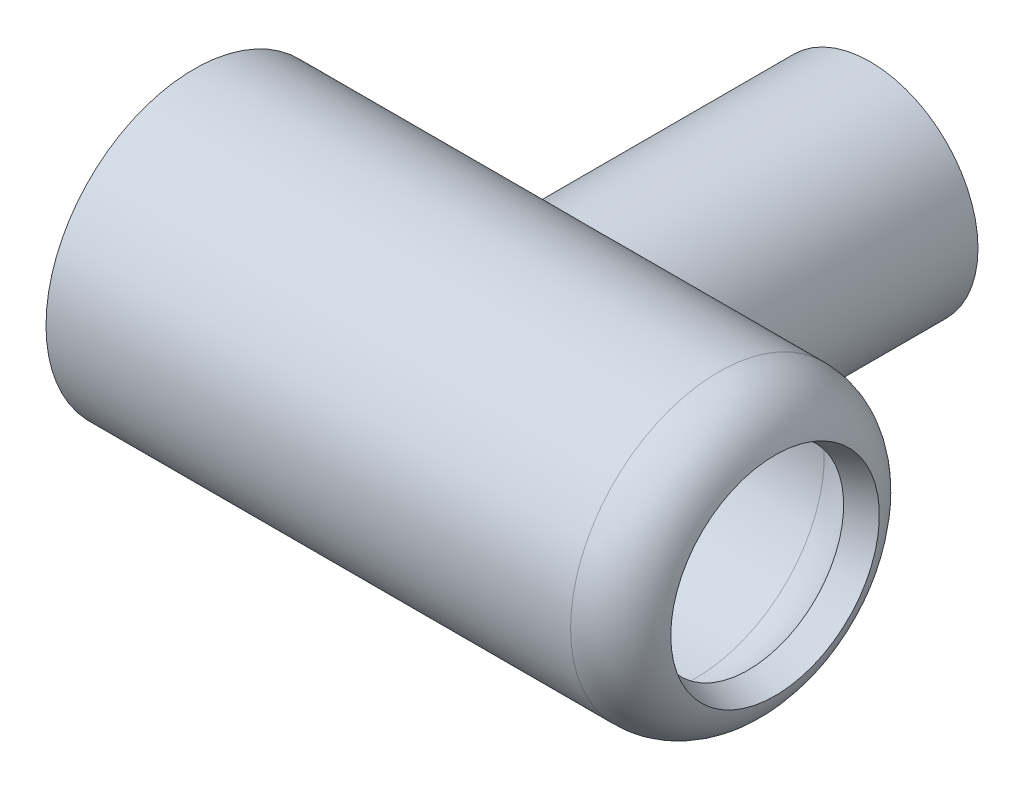
from build123d import *

# Parameters (mm, degrees)
SKIZZE3_R                       = 9.25
SCHNITT_LINEAR_AUSTRAGEN1_DEPTH = 30
SKIZZE5_R                       = 9.25
SKIZZE5_R_2                     = 5.72
AUFSATZ_LINEAR_AUSTRAGEN1_DEPTH = 25


with BuildPart() as part:
    # Skizze1 → Rotation1 (revolve)
    with BuildSketch(Plane.XY):
        with BuildLine():
            Line((-25, 12.7), (20, 12.7))
            ThreePointArc((20, 12.7), (23.535533906, 11.235533906), (25, 7.7))
            Line((25, 7.7), (25, 0))
            Line((25, 0), (23.01981108, 0))
            Line((23.01981108, 0), (23.01981108, 6.05))
            ThreePointArc((23.01981108, 6.05), (21.555344986, 9.585533906), (18.01981108, 11.05))
            Line((18.01981108, 11.05), (-25, 11.05))
            Line((-25, 11.05), (-25, 12.7))
        make_face()
    revolve(axis=Axis((-16.35087822, 0, 0), (1, 0, 0)))

    # Skizze2 → Schnitt-Rotation1 (revolve, cut)
    with BuildSketch(Plane(origin=(0, 0, 0), x_dir=(1, 0, 0), z_dir=(0, 1, 0))):
        Polygon((22, 0), (22, 8), (25, 9), (25, 0), align=None)
    revolve(axis=Axis((-29.523851761, 0, 0), (1, 0, 0)), mode=Mode.SUBTRACT)

    # Skizze3 → Schnitt-Linear austragen1 (cut)
    with BuildSketch(Plane.XY):
        Circle(SKIZZE3_R)
    extrude(amount=-SCHNITT_LINEAR_AUSTRAGEN1_DEPTH, mode=Mode.SUBTRACT)

    # Skizze5 → Aufsatz-Linear austragen1 (add)
    with BuildSketch(Plane.XY.offset(-8)):
        Circle(SKIZZE5_R)
        Circle(SKIZZE5_R_2, mode=Mode.SUBTRACT)
    extrude(amount=-AUFSATZ_LINEAR_AUSTRAGEN1_DEPTH)


solid = part.part
